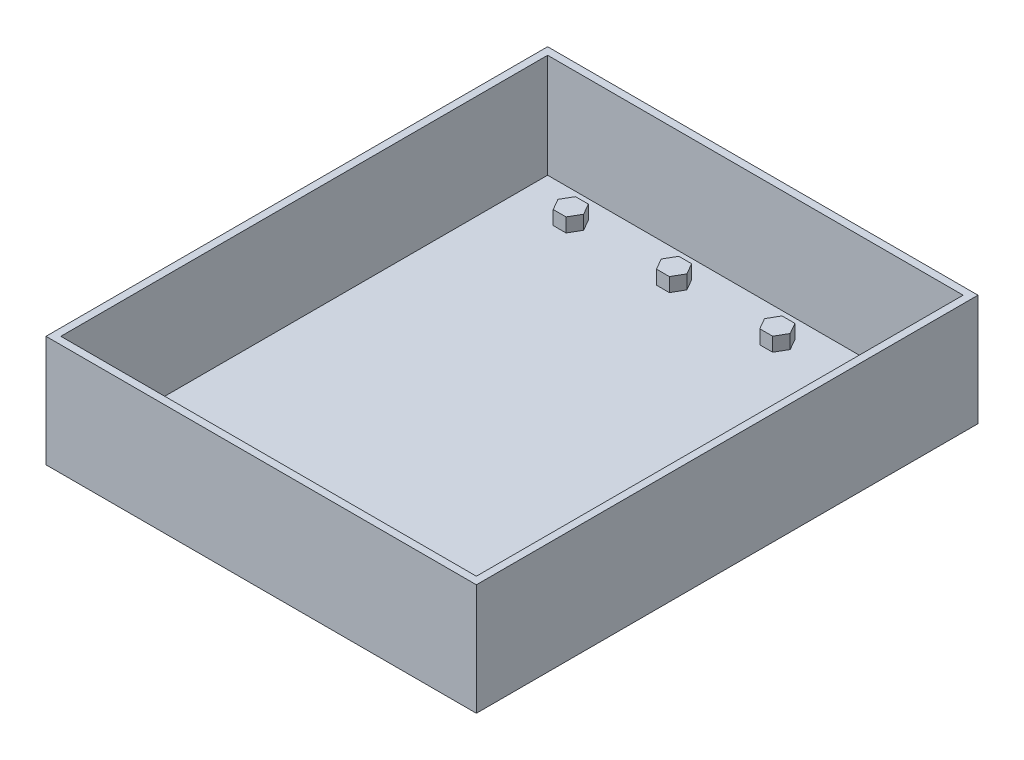
from build123d import *

# Parameters (mm, degrees)
SKETCH1_W           = 184.15
SKETCH1_H           = 214.63
BOSS_EXTRUDE1_DEPTH = 47.625
SHELL1_T            = -3.175
BOSS_EXTRUDE2_DEPTH = 5.953125


with BuildPart() as part:
    # Sketch1 → Boss-Extrude1 (new body)
    with BuildSketch(Plane(origin=(0, 0, 0), x_dir=(1, 0, 0), z_dir=(0, 1, 0))):
        Rectangle(SKETCH1_W, SKETCH1_H)
    extrude(amount=BOSS_EXTRUDE1_DEPTH)

    # Shell1
    shell1_openings = [part.faces().sort_by_distance(p)[0] for p in [
        (0, 47.625, 0),
    ]]
    offset(amount=SHELL1_T, openings=shell1_openings, kind=Kind.INTERSECTION)

    # Sketch3 → Boss-Extrude2 (add)
    with BuildSketch(Plane(origin=(0, 3.175, 0), x_dir=(1, 0, 0), z_dir=(0, 1, 0))):
        Polygon((-27.597261314, -91.44), (-24.847630657, -96.2025), (-19.348369343, -96.2025), (-16.598738686, -91.44), (-19.348369343, -86.6775), (-24.847630657, -86.6775), align=None)
        Polygon((-71.793261314, -91.44), (-69.043630657, -96.2025), (-63.544369343, -96.2025), (-60.794738686, -91.44), (-63.544369343, -86.6775), (-69.043630657, -86.6775), align=None)
        Polygon((16.598738686, -91.44), (19.348369343, -96.2025), (24.847630657, -96.2025), (27.597261314, -91.44), (24.847630657, -86.6775), (19.348369343, -86.6775), align=None)
        Polygon((60.794738686, -91.44), (63.544369343, -96.2025), (69.043630657, -96.2025), (71.793261314, -91.44), (69.043630657, -86.6775), (63.544369343, -86.6775), align=None)
        Polygon((-27.597261314, 91.44), (-24.847630657, 86.6775), (-19.348369343, 86.6775), (-16.598738686, 91.44), (-19.348369343, 96.2025), (-24.847630657, 96.2025), align=None)
        Polygon((16.598738686, 91.44), (19.348369343, 86.6775), (24.847630657, 86.6775), (27.597261314, 91.44), (24.847630657, 96.2025), (19.348369343, 96.2025), align=None)
        Polygon((60.794738686, 91.44), (63.544369343, 86.6775), (69.043630657, 86.6775), (71.793261314, 91.44), (69.043630657, 96.2025), (63.544369343, 96.2025), align=None)
        Polygon((-71.793261314, 91.44), (-69.043630657, 86.6775), (-63.544369343, 86.6775), (-60.794738686, 91.44), (-63.544369343, 96.2025), (-69.043630657, 96.2025), align=None)
    extrude(amount=BOSS_EXTRUDE2_DEPTH)


solid = part.part
